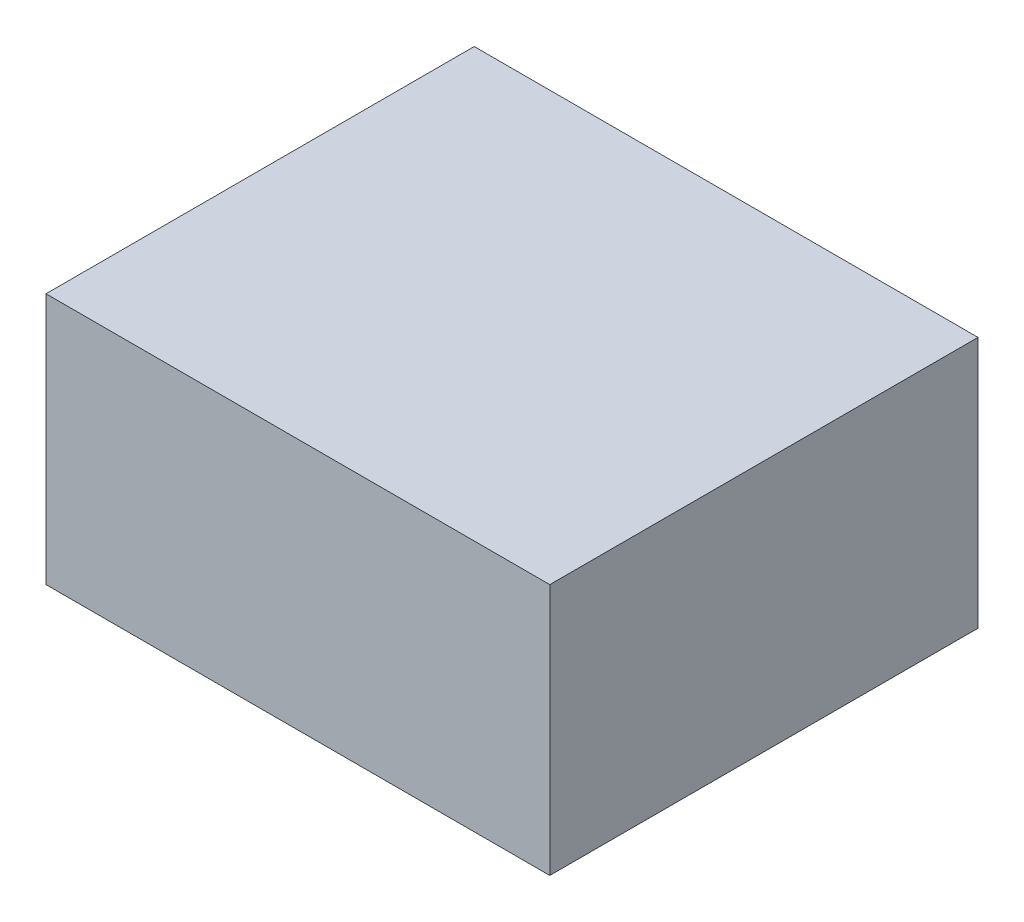
from build123d import *

# Parameters (mm, degrees)
BOSS_EXTRUDE1_DEPTH      = 5
BOSS_EXTRUDE1_DEPTH_BACK = 12
SKETCH1_W                = 20
SKETCH1_H                = 10


with BuildPart() as part:
    # Sketch1 → Boss-Extrude1 (new, two sides: drawn at the far end of the back side and taken through both)
    with BuildSketch(Plane.XY.offset(-BOSS_EXTRUDE1_DEPTH_BACK)):
        with Locations((10, 5)):
            Rectangle(SKETCH1_W, SKETCH1_H)
    extrude(amount=BOSS_EXTRUDE1_DEPTH + BOSS_EXTRUDE1_DEPTH_BACK)


solid = part.part
